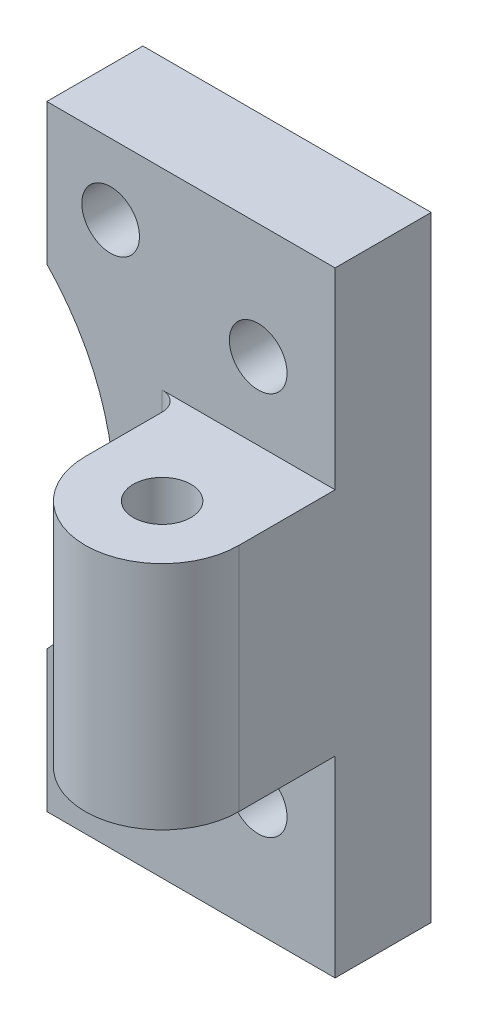
from build123d import *

# Parameters (mm, degrees)
SKETCH1_W                         = 19.05
SKETCH1_H                         = 25.4
BOSS_EXTRUDE1_DEPTH               = 3.96875
SKETCH2_R                         = 9.921875
CUT_EXTRUDE1_DEPTH                = 24.236683855
SKETCH3_W                         = 7.14375
SKETCH3_H                         = 25.4
CUT_EXTRUDE2_DEPTH                = 24.236683855
SKETCH4_W                         = 6.35
SKETCH4_H                         = 9.525
BOSS_EXTRUDE2_DEPTH               = 7.14375
TAP_DRILL_FOR_2_HELICOIL1_D       = 2.38252
TAP_DRILL_FOR_2_HELICOIL3_D       = 2.38252
TAP_DRILL_FOR_2_HELICOIL3_DEPTH   = 4.7371
TAP_DRILL_FOR_2_HELICOIL3_TIP     = 0.715781221
TAP_DRILL_FOR_2_HELICOIL3_2_D     = 2.38252
TAP_DRILL_FOR_2_HELICOIL3_2_DEPTH = 4.7371
TAP_DRILL_FOR_2_HELICOIL3_2_TIP   = 0.715781221
FILLET1_R                         = 0.79375
FILLET2_RADIUS                    = 3.175
FILLET2_LENGTH                    = 9.525


with BuildPart() as part:
    # Sketch1 → Boss-Extrude1 (new body)
    with BuildSketch(Plane.XY):
        with Locations((9.525, 0)):
            Rectangle(SKETCH1_W, SKETCH1_H)
    extrude(amount=BOSS_EXTRUDE1_DEPTH)

    # Sketch2 → Cut-Extrude1 (cut, through all)
    with BuildSketch(Plane.XY.offset(3.96875)):
        Circle(SKETCH2_R)
    extrude(amount=-CUT_EXTRUDE1_DEPTH, mode=Mode.SUBTRACT)

    # Sketch3 → Cut-Extrude2 (cut, through all)
    with BuildSketch(Plane.XY.offset(3.96875)):
        with Locations((3.571875, 0)):
            Rectangle(SKETCH3_W, SKETCH3_H)
    extrude(amount=-CUT_EXTRUDE2_DEPTH, mode=Mode.SUBTRACT)

    # Sketch4 → Boss-Extrude2 (add)
    with BuildSketch(Plane.XY.offset(3.96875)):
        with Locations((15.875, 0)):
            Rectangle(SKETCH4_W, SKETCH4_H)
    extrude(amount=BOSS_EXTRUDE2_DEPTH)

    # Tap Drill for #2 Helicoil1 (through all)
    with Locations(Plane(origin=(0, 0, 0), x_dir=(-1, 0, 0), z_dir=(0, 0, -1))):
        with Locations((-9.779, 9.779), (-9.779, -9.779), (-15.875, 7.9375), (-15.875, -7.9375)):
            Hole(TAP_DRILL_FOR_2_HELICOIL1_D / 2)

    # Tap Drill for _2 Helicoil3
    with Locations(Plane(origin=(0, 4.7625, 0), x_dir=(1, 0, 0), z_dir=(0, 1, 0))):
        with Locations((15.875, -7.9375)):
            Hole(TAP_DRILL_FOR_2_HELICOIL3_D / 2, depth=TAP_DRILL_FOR_2_HELICOIL3_DEPTH)
            with Locations((0, 0, -(TAP_DRILL_FOR_2_HELICOIL3_DEPTH + TAP_DRILL_FOR_2_HELICOIL3_TIP / 2))):  # 118° drill point
                Cone(0, TAP_DRILL_FOR_2_HELICOIL3_D / 2, TAP_DRILL_FOR_2_HELICOIL3_TIP, mode=Mode.SUBTRACT)

    # Tap Drill for _2 Helicoil3 2
    with Locations(Plane(origin=(0, -4.7625, 0), x_dir=(-1, 0, 0), z_dir=(0, -1, 0))):
        with Locations((-15.875, -7.9375)):
            Hole(TAP_DRILL_FOR_2_HELICOIL3_2_D / 2, depth=TAP_DRILL_FOR_2_HELICOIL3_2_DEPTH)
            with Locations((0, 0, -(TAP_DRILL_FOR_2_HELICOIL3_2_DEPTH + TAP_DRILL_FOR_2_HELICOIL3_2_TIP / 2))):  # 118° drill point
                Cone(0, TAP_DRILL_FOR_2_HELICOIL3_2_D / 2, TAP_DRILL_FOR_2_HELICOIL3_2_TIP, mode=Mode.SUBTRACT)

    # Fillet1
    fillet1_edges = [part.edges().sort_by_distance(p)[0] for p in [
        (12.7, 0, 3.96875),
    ]]
    fillet(fillet1_edges, radius=FILLET1_R)

    # Fillet2: full round fillet: the end face becomes a half cylinder, R = half its width
    fillet2_face = Plane((15.875, 0, 11.1125), x_dir=(0, 1, 0), z_dir=(0, 0, 1))  # on the end face: x along it, z out of the body
    fillet2_slab = fillet2_face.offset(-FILLET2_RADIUS / 2) * Box(FILLET2_LENGTH, 2 * FILLET2_RADIUS, FILLET2_RADIUS, mode=Mode.PRIVATE)  # the body's end, R deep
    fillet2_round = Plane((15.875, 0, 7.9375), x_dir=(0, 0, 1), z_dir=(0, 1, 0)) * Cylinder(FILLET2_RADIUS, FILLET2_LENGTH, mode=Mode.PRIVATE)  # its axis R under the face
    add(fillet2_slab - fillet2_round, mode=Mode.SUBTRACT)


solid = part.part
